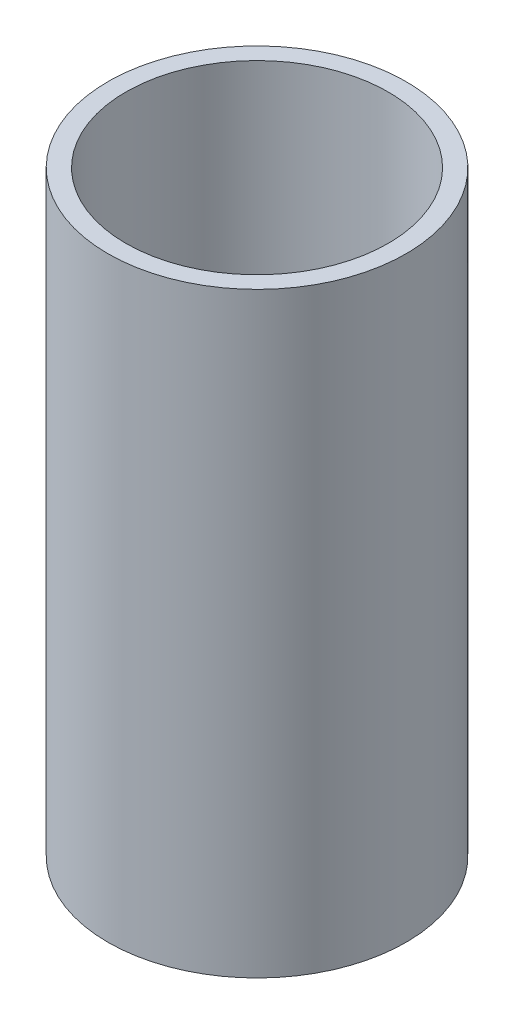
from build123d import *

# Parameters (mm, degrees)
SKETCH_1_R      = 25
SKETCH_1_R_2    = 22
EXTRUDE_1_DEPTH = 100


with BuildPart() as part:
    # 草圖1 → 填料-伸長1 (new body)
    with BuildSketch(Plane(origin=(0, 0, 0), x_dir=(1, 0, 0), z_dir=(0, 1, 0))):
        with Locations(Location((0, 0, 0), (0, 0, 270))):
            Circle(SKETCH_1_R)
        with Locations(Location((0, 0, 0), (0, 0, 270))):
            Circle(SKETCH_1_R_2, mode=Mode.SUBTRACT)
    extrude(amount=EXTRUDE_1_DEPTH)


solid = part.part
